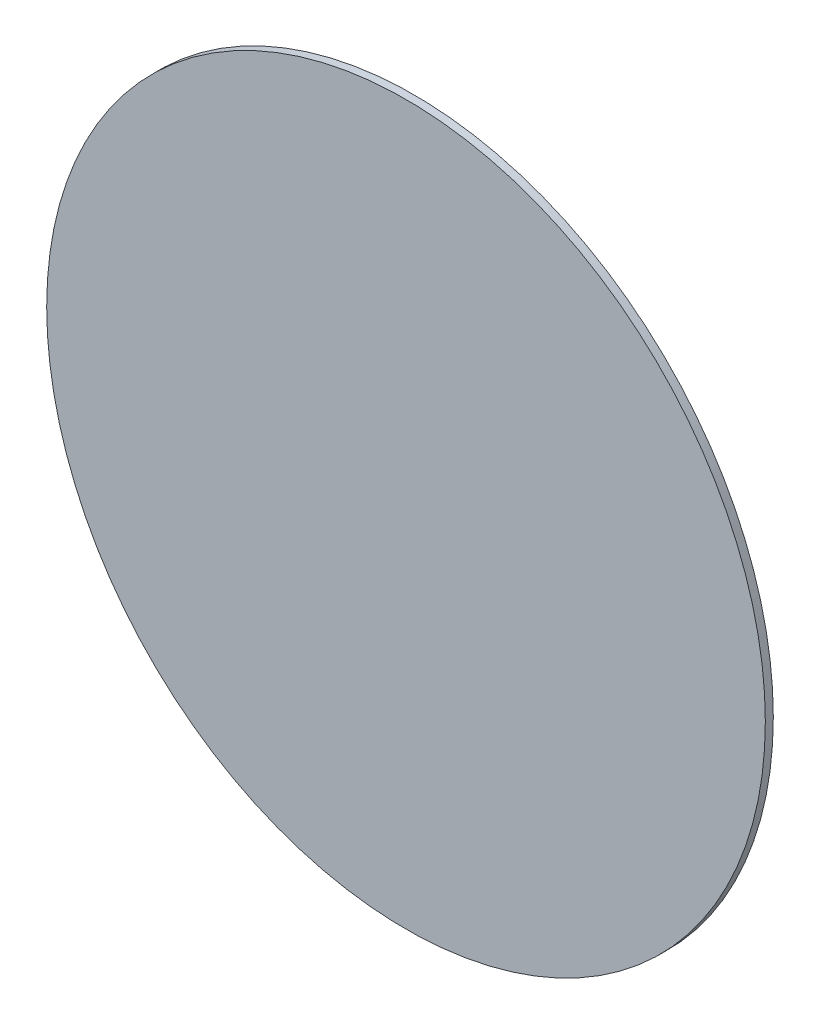
from build123d import *

# Parameters (mm, degrees)
SKETCH1_R           = 90
BOSS_EXTRUDE1_DEPTH = 2


with BuildPart() as part:
    # Sketch1 → Boss-Extrude1 (new body)
    with BuildSketch(Plane.XY):
        Circle(SKETCH1_R)
    extrude(amount=BOSS_EXTRUDE1_DEPTH)


solid = part.part
